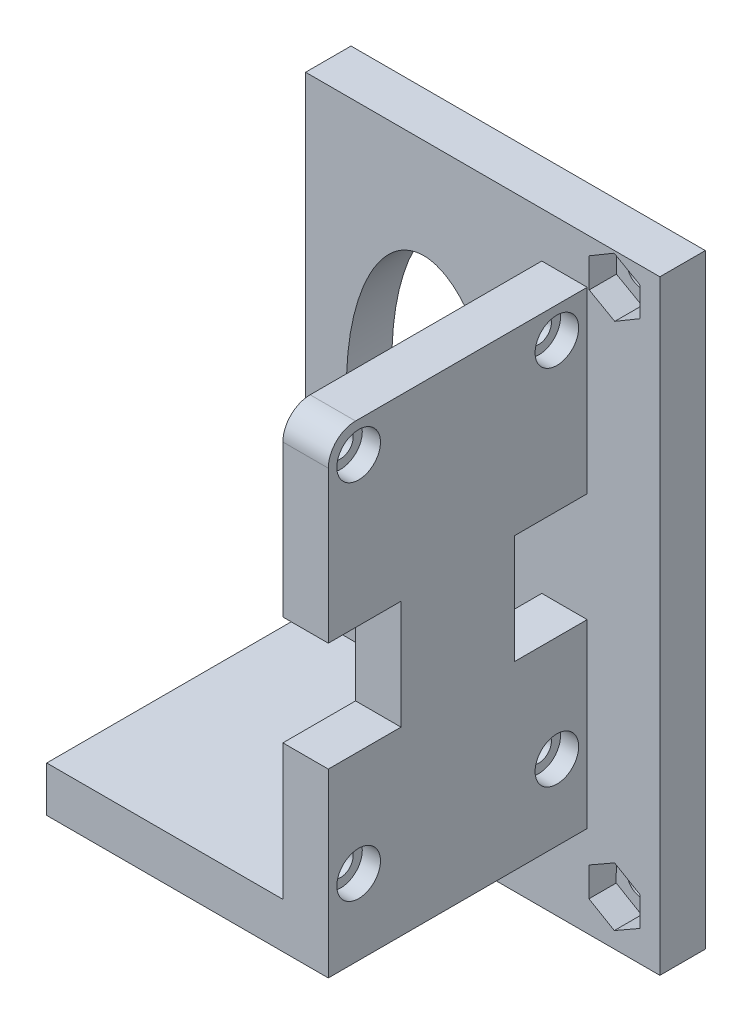
from build123d import *

# Parameters (mm, degrees)
SKETCH1_W           = 39
SKETCH1_H           = 66.6
SKETCH1_R           = 1.625
BOSS_EXTRUDE1_DEPTH = 5
BOSS_EXTRUDE3_DEPTH = 33.5
CUT_EXTRUDE5_START  = 5
CUT_EXTRUDE5_DEPTH  = 3
FILLET1_R           = 3
SKETCH3_R           = 1.4
SKETCH3_W           = 8
SKETCH3_H           = 12
CUT_EXTRUDE6_DEPTH  = 62.473243338
SKETCH3_3_R         = 2.4
SKETCH3_3_R_2       = 1.4
CUT_EXTRUDE7_DEPTH  = 2


with BuildPart() as part:
    # Sketch1 → Boss-Extrude1 (new body)
    with BuildSketch(Plane.XY):
        with Locations((-26.524184287, 7.878995035)):
            Rectangle(SKETCH1_W, SKETCH1_H)
        with Locations((-12.024184287, -20.421004965)):
            Circle(SKETCH1_R, mode=Mode.SUBTRACT)
        with BuildLine():
            add(Edge.make_bspline(
                [(-33.024184287, 30.194508602), (-47.746616151, 30.194508602), (-40.385400219, 5.271238252), (-33.024184287, -19.652032099), (-25.662968354, 5.271238252), (-18.301752422, 30.194508602), (-33.024184287, 30.194508602)],
                knots=[0, 0, 0, 2.094395102, 2.094395102, 4.188790205, 4.188790205, 6.283185307, 6.283185307, 6.283185307], degree=2, weights=[1, 0.5, 1, 0.5, 1, 0.5, 1]))
        make_face(mode=Mode.SUBTRACT)
        with Locations((-12.024184287, 37.678995035)):
            Circle(SKETCH1_R, mode=Mode.SUBTRACT)
        with Locations((-41.024184287, -20.421004965)):
            Circle(SKETCH1_R, mode=Mode.SUBTRACT)
    extrude(amount=BOSS_EXTRUDE1_DEPTH)

    # Sketch1<3> → Boss-Extrude3 (add)
    with BuildSketch(Plane.XY):
        Polygon((-20.024184287, -10.421004965), (-46.024184287, -10.421004965), (-46.024184287, -12.421004965), (-46.024184287, -15.421004965), (-15.024184287, -15.421004965), (-15.024184287, 36.178995035), (-20.024184287, 36.178995035), align=None)
    extrude(amount=BOSS_EXTRUDE3_DEPTH)

    # Sketch1<6> → Cut-Extrude5 (cut)
    with BuildSketch(Plane.XY.offset(CUT_EXTRUDE5_START)):
        Polygon((-41.008426388, -23.654128071), (-43.816272081, -22.051213259), (-43.83202998, -18.818090152), (-41.039942185, -17.187881858), (-38.232096492, -18.790796671), (-38.216338594, -22.023919778), align=None)
        Polygon((-14.840760077, 39.266519571), (-14.807308759, 36.033531117), (-11.990732969, 34.446006581), (-9.207608497, 36.091470499), (-9.241059814, 39.324458953), (-12.057635604, 40.911983489), align=None)
        Polygon((-9.232096492, -22.051213259), (-9.216338594, -18.818090152), (-12.008426388, -17.187881858), (-14.816272081, -18.790796671), (-14.83202998, -22.023919778), (-12.039942185, -23.654128071), align=None)
    extrude(amount=-CUT_EXTRUDE5_DEPTH, mode=Mode.SUBTRACT)

    # Fillet1
    fillet1_edges = [part.edges().sort_by_distance(p)[0] for p in [
        (-17.524184287, 36.178995035, 33.5),
    ]]
    fillet(fillet1_edges, radius=FILLET1_R)

    # Sketch3 → Cut-Extrude6 (cut, through all)
    with BuildSketch(Plane(origin=(-15.024184287, 0, 0), x_dir=(0, 0, -1), z_dir=(1, 0, 0))):
        with Locations((-30.15981065, 32.795843126)):
            Circle(SKETCH3_R)
        with Locations((-8.34018935, 32.795843126)):
            Circle(SKETCH3_R)
        with Locations((-8.34018935, -7.121004965)):
            Circle(SKETCH3_R)
        with Locations((-30.15981065, -7.121004965)):
            Circle(SKETCH3_R)
        with Locations((-29.5, 10.495843125)):
            Rectangle(SKETCH3_W, SKETCH3_H)
        with Locations((-9, 10.495843125)):
            Rectangle(SKETCH3_W, SKETCH3_H)
    extrude(amount=-CUT_EXTRUDE6_DEPTH, mode=Mode.SUBTRACT)

    # Sketch3<3> → Cut-Extrude7 (cut)
    # profile 1 of 4: a face of its own
    with BuildSketch(Plane(origin=(-15.024184287, 0, 0), x_dir=(0, 0, -1), z_dir=(1, 0, 0))):
        with Locations((-8.34018935, 32.795843126)):
            Circle(SKETCH3_3_R)
        with Locations((-8.34018935, 32.795843126)):
            Circle(SKETCH3_3_R_2, mode=Mode.SUBTRACT)
    # profile 2 of 4: a face of its own
    with BuildSketch(Plane(origin=(-15.024184287, 0, 0), x_dir=(0, 0, -1), z_dir=(1, 0, 0))):
        with Locations((-30.15981065, 32.795843126)):
            Circle(SKETCH3_3_R)
        with Locations((-30.15981065, 32.795843126)):
            Circle(SKETCH3_3_R_2, mode=Mode.SUBTRACT)
    # profile 3 of 4: a face of its own
    with BuildSketch(Plane(origin=(-15.024184287, 0, 0), x_dir=(0, 0, -1), z_dir=(1, 0, 0))):
        with Locations((-30.15981065, -7.121004965)):
            Circle(SKETCH3_3_R)
        with Locations((-30.15981065, -7.121004965)):
            Circle(SKETCH3_3_R_2, mode=Mode.SUBTRACT)
    # profile 4 of 4: a face of its own
    with BuildSketch(Plane(origin=(-15.024184287, 0, 0), x_dir=(0, 0, -1), z_dir=(1, 0, 0))):
        with Locations((-8.34018935, -7.121004965)):
            Circle(SKETCH3_3_R)
        with Locations((-8.34018935, -7.121004965)):
            Circle(SKETCH3_3_R_2, mode=Mode.SUBTRACT)
    extrude(amount=-CUT_EXTRUDE7_DEPTH, mode=Mode.SUBTRACT)


solid = part.part
